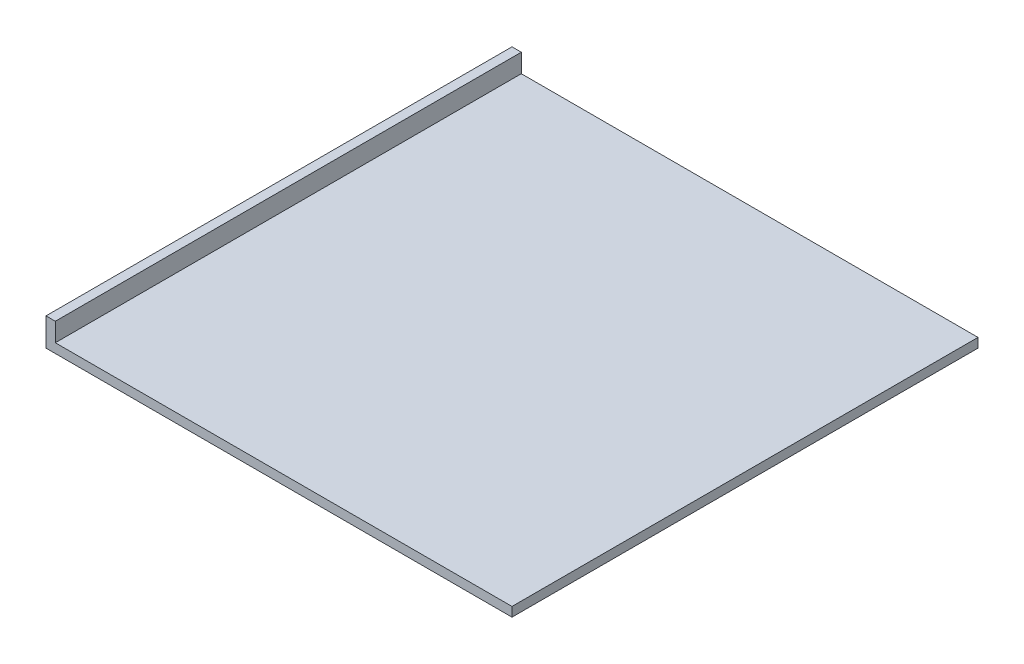
from build123d import *

# Parameters (mm, degrees)
SKETCH1_W           = 500
SKETCH1_H           = 500
BOSS_EXTRUDE1_DEPTH = 10
SKETCH2_W           = 10
SKETCH2_H           = 500
BOSS_EXTRUDE2_DEPTH = 20
SKETCH3_W           = 24.824794579
SKETCH3_H           = 41.535737198
SKETCH3_H_2         = 47.922361064
SKETCH3_W_2         = 15.07825301
SKETCH3_H_3         = 20.670620926
BOSS_EXTRUDE3_DEPTH = 10
CUT_EXTRUDE4_DEPTH  = 50
CUT_EXTRUDE5_DEPTH  = 50
CUT_EXTRUDE6_DEPTH  = 22


with BuildPart() as part:
    # Sketch1 → Boss-Extrude1 (new body)
    with BuildSketch(Plane(origin=(0, 0, 0), x_dir=(1, 0, 0), z_dir=(0, 1, 0))):
        Rectangle(SKETCH1_W, SKETCH1_H)
    extrude(amount=BOSS_EXTRUDE1_DEPTH)

    # Sketch2 → Boss-Extrude2 (add)
    with BuildSketch(Plane(origin=(0, 10, 0), x_dir=(1, 0, 0), z_dir=(0, 1, 0))):
        with Locations((-245, 0)):
            Rectangle(SKETCH2_W, SKETCH2_H)
    extrude(amount=BOSS_EXTRUDE2_DEPTH)

    # Sketch3 → Boss-Extrude3 (add)
    with BuildSketch(Plane.XZ):
        with Locations((181.563787456, -100.472088386)):
            Rectangle(SKETCH3_W, SKETCH3_H)
        with Locations((169.151390168, -160.909121908)):
            Rectangle(SKETCH3_W, SKETCH3_H_2)
        with Locations((193.976184746, -136.947941376)):
            Rectangle(SKETCH3_W_2, SKETCH3_H_3)
    extrude(amount=BOSS_EXTRUDE3_DEPTH)

    # Sketch6 → Cut-Extrude4 (cut)
    with BuildSketch(Plane(origin=(0, 0, -184.87030244), x_dir=(-1, 0, 0), z_dir=(0, 0, -1))):
        Polygon((-156.738992878, -10), (-162.512495569, 0), (-156.738992878, 0), align=None)
        Polygon((-175.790284765, 0), (-181.563787457, 0), (-181.563787457, -10), align=None)
    extrude(amount=-CUT_EXTRUDE4_DEPTH, mode=Mode.SUBTRACT)

    # Sketch5 → Cut-Extrude5 (cut)
    with BuildSketch(Plane(origin=(0, 0, -121.239956985), x_dir=(-1, 0, 0), z_dir=(0, 0, -1))):
        Polygon((-172.79109251, 0), (-169.151390167, -10), (-169.151390167, 0), align=None)
        Polygon((-193.976184746, -10), (-190.336482403, 0), (-193.976184746, 0), align=None)
    extrude(amount=-CUT_EXTRUDE5_DEPTH, mode=Mode.SUBTRACT)

    # Sketch4 → Cut-Extrude6 (cut)
    with BuildSketch(Plane(origin=(0, 0, -147.283251839), x_dir=(-1, 0, 0), z_dir=(0, 0, -1))):
        Polygon((-186.437058241, -10), (-188.200328049, 0), (-186.437058241, 0), align=None)
        Polygon((-199.752041444, 0), (-201.515311251, 0), (-201.515311251, -10), align=None)
    extrude(amount=-CUT_EXTRUDE6_DEPTH, mode=Mode.SUBTRACT)


solid = part.part
